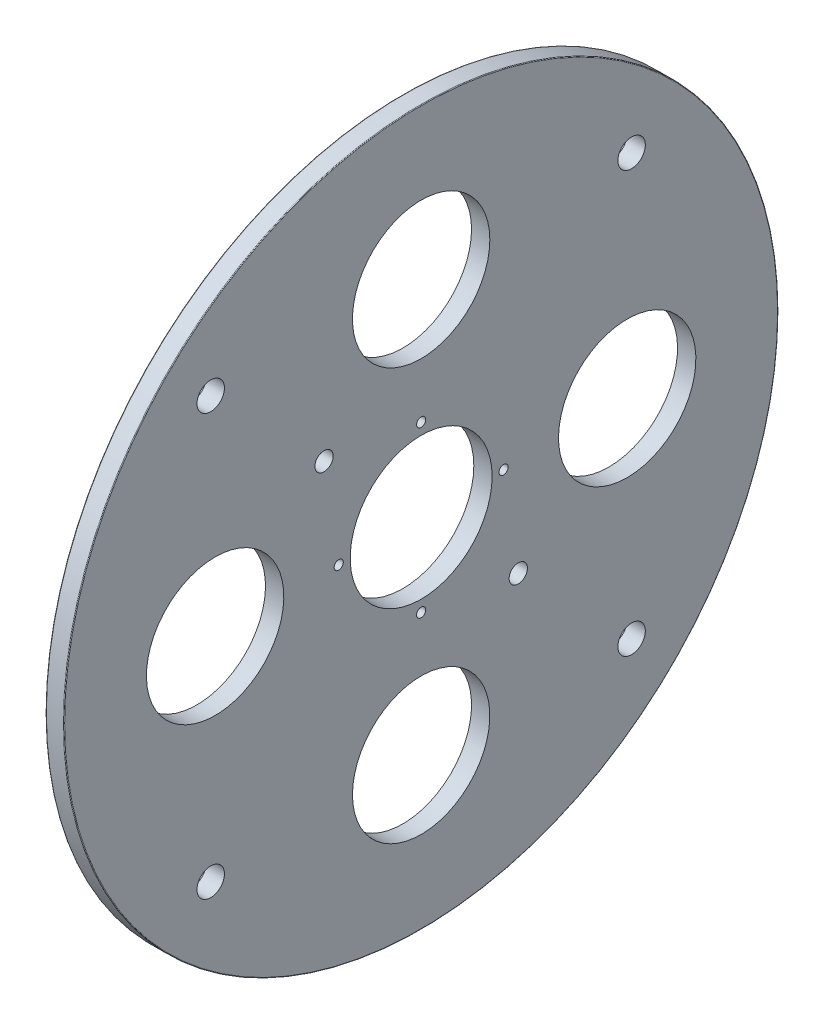
from build123d import *

# Parameters (mm, degrees)
SKETCH_1_R               = 156
EXTRUDE_1_DEPTH          = 8
SKETCH_2_R               = 31
CUT_EXTRUDE_1_DEPTH      = 10
SKETCH_4_R               = 6
CUT_EXTRUDE_3_DEPTH      = 10
PATTERN_CIRCULAR_2_COUNT = 4
SKETCH_6_R               = 2
CUT_EXTRUDE_5_DEPTH      = 10
PATTERN_CIRCULAR_4_COUNT = 4
FILLET_1_R               = 0.3
SKETCH_8_R               = 4
CUT_EXTRUDE_7_DEPTH      = 10
SKETCH_9_R               = 30
CUT_EXTRUDE_8_DEPTH      = 10
PATTERN_CIRCULAR_6_COUNT = 4
PATTERN_CIRCULAR_7_COUNT = 2


with BuildPart() as part:
    # 草图1 → 凸台-拉伸1 (new body)
    with BuildSketch(Plane(origin=(0, 0, 0), x_dir=(0, 0, -1), z_dir=(1, 0, 0))):
        Circle(SKETCH_1_R)
    extrude(amount=EXTRUDE_1_DEPTH)

    # 草图2 → 切除-拉伸1 (cut)
    with BuildSketch(Plane(origin=(8, 0, 0), x_dir=(0, 0, -1), z_dir=(1, 0, 0))):
        Circle(SKETCH_2_R)
    extrude(amount=-CUT_EXTRUDE_1_DEPTH, mode=Mode.SUBTRACT)

    # 草图4 → 切除-拉伸3 (cut)
    with BuildSketch(Plane(origin=(8, 0, 0), x_dir=(0, 0, -1), z_dir=(1, 0, 0))):
        with Locations((91.923881554, 91.923881554)):
            Circle(SKETCH_4_R)
    cut_extrude_3 = extrude(amount=-CUT_EXTRUDE_3_DEPTH, mode=Mode.SUBTRACT)

    # 阵列(圆周)2: 切除-拉伸3 ×4 about axis
    pattern_circular_2_axis = Axis((0, 0, 0), (1, 0, 0))
    for i in range(1, PATTERN_CIRCULAR_2_COUNT):
        add(cut_extrude_3.rotate(pattern_circular_2_axis, i * 360 / PATTERN_CIRCULAR_2_COUNT), mode=Mode.SUBTRACT)

    # 草图6 → 切除-拉伸5 (cut)
    with BuildSketch(Plane(origin=(8, 0, 0), x_dir=(0, 0, -1), z_dir=(1, 0, 0))):
        with Locations((0, 36)):
            Circle(SKETCH_6_R)
    cut_extrude_5 = extrude(amount=-CUT_EXTRUDE_5_DEPTH, mode=Mode.SUBTRACT)

    # 阵列(圆周)4: 切除-拉伸5 ×4 about axis
    pattern_circular_4_axis = Axis((0, 0, 0), (1, 0, 0))
    for i in range(1, PATTERN_CIRCULAR_4_COUNT):
        add(cut_extrude_5.rotate(pattern_circular_4_axis, i * 360 / PATTERN_CIRCULAR_4_COUNT), mode=Mode.SUBTRACT)

    # 圆角1
    fillet_1_edges = [part.edges().sort_by_distance(p)[0] for p in [
        (0, 0, 156),
        (8, 0, 156),
    ]]
    fillet(fillet_1_edges, radius=FILLET_1_R)

    # 草图8 → 切除-拉伸7 (cut)
    with BuildSketch(Plane(origin=(8, 0, 0), x_dir=(0, 0, -1), z_dir=(1, 0, 0))):
        with Locations((42.426406871, -42.426406871)):
            Circle(SKETCH_8_R)
    cut_extrude_7 = extrude(amount=-CUT_EXTRUDE_7_DEPTH, mode=Mode.SUBTRACT)

    # 草图9 → 切除-拉伸8 (cut)
    with BuildSketch(Plane(origin=(8, 0, 0), x_dir=(0, 0, -1), z_dir=(1, 0, 0))):
        with Locations((0, 90)):
            Circle(SKETCH_9_R)
    cut_extrude_8 = extrude(amount=-CUT_EXTRUDE_8_DEPTH, mode=Mode.SUBTRACT)

    # 阵列(圆周)6: 切除-拉伸8 ×4 about axis
    pattern_circular_6_axis = Axis((0, 0, 0), (1, 0, 0))
    for i in range(1, PATTERN_CIRCULAR_6_COUNT):
        add(cut_extrude_8.rotate(pattern_circular_6_axis, i * 360 / PATTERN_CIRCULAR_6_COUNT), mode=Mode.SUBTRACT)

    # 阵列(圆周)7: 切除-拉伸7 ×2 about axis
    pattern_circular_7_axis = Axis((0, 0, 0), (1, 0, 0))
    for i in range(1, PATTERN_CIRCULAR_7_COUNT):
        add(cut_extrude_7.rotate(pattern_circular_7_axis, i * 360 / PATTERN_CIRCULAR_7_COUNT), mode=Mode.SUBTRACT)


solid = part.part
